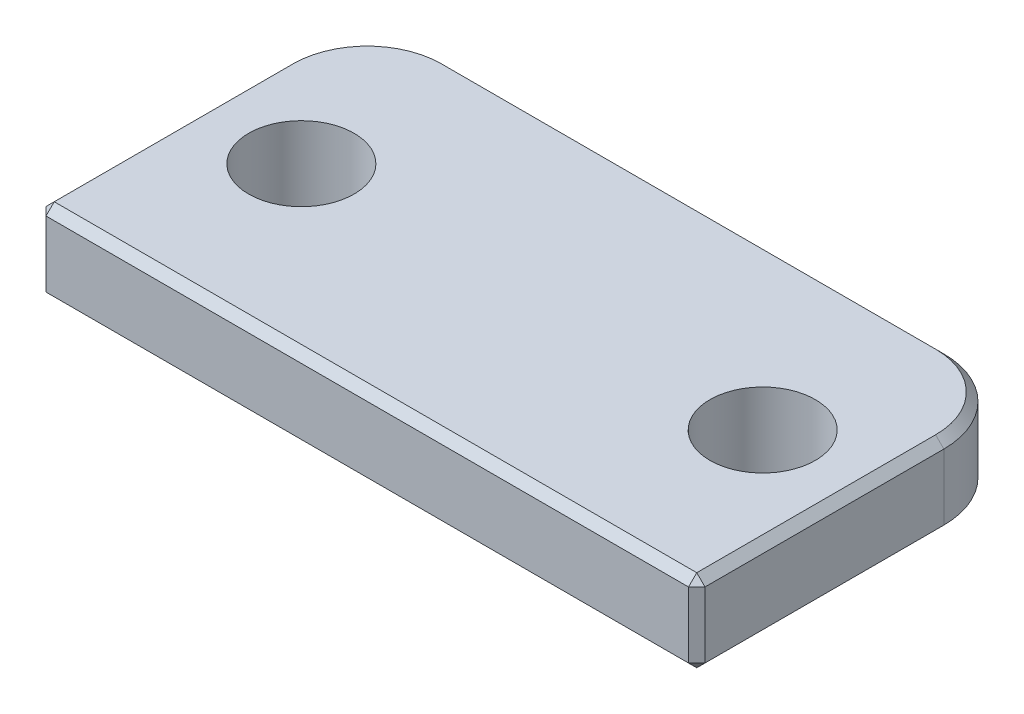
from build123d import *

# Parameters (mm, degrees)
SKETCH1_W            = 40
SKETCH1_H            = 20
BOSS_EXTRUDE1_DEPTH  = 5
M6_CLEARANCE_HOLE1_D = 6.4
FILLET1_R            = 5
CHAMFER1_SIZE        = 0.5


with BuildPart() as part:
    # Sketch1 → Boss-Extrude1 (new body)
    with BuildSketch(Plane(origin=(0, 0, 0), x_dir=(1, 0, 0), z_dir=(0, 1, 0))):
        Rectangle(SKETCH1_W, SKETCH1_H)
    extrude(amount=BOSS_EXTRUDE1_DEPTH)

    # M6 Clearance Hole1 (through all)
    with Locations(Plane(origin=(0, 5, 0), x_dir=(1, 0, 0), z_dir=(0, 1, 0))):
        with Locations((-14, 0), (14, 0)):
            Hole(M6_CLEARANCE_HOLE1_D / 2)

    # Fillet1
    fillet1_edges = [part.edges().sort_by_distance(p)[0] for p in [
        (-20, 2.5, -10),
        (20, 2.5, -10),
    ]]
    fillet(fillet1_edges, radius=FILLET1_R)

    # Chamfer1
    chamfer1_edges = [part.edges().sort_by_distance(p)[0] for p in [
        (0, 5, 10),
        (-20, 0, 2.5),
        (-20, 5, 2.5),
        (0, 0, -10),
        (18.535533906, 0, -8.535533906),
        (-18.535533906, 0, -8.535533906),
        (0, 5, -10),
        (18.535533906, 5, -8.535533906),
        (-18.535533906, 5, -8.535533906),
        (20, 5, 2.5),
        (0, 0, 10),
        (20, 0, 2.5),
        (20, 2.5, 10),
        (-20, 2.5, 10),
    ]]
    chamfer(chamfer1_edges, length=CHAMFER1_SIZE)


solid = part.part
